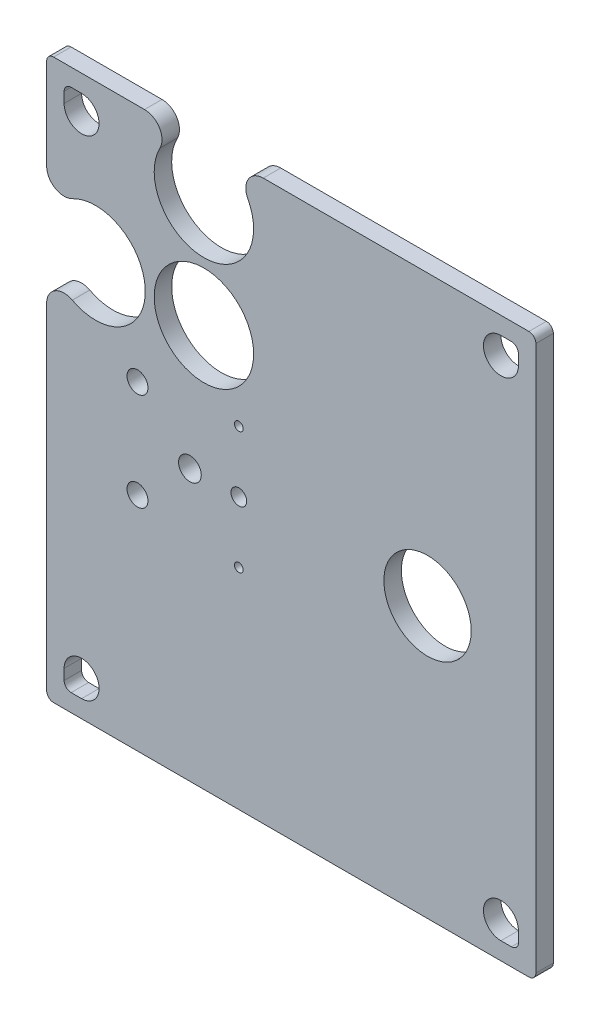
from build123d import *

# Parameters (mm, degrees)
MODEL_R             = 3
MODEL_R_2           = 2.25
MODEL_R_3           = 1.25
MODEL_R_4           = 12.5
MODEL_R_5           = 3.25
MODEL_R_6           = 14.225
BOSS_EXTRUDE1_DEPTH = 5


with BuildPart() as part:
    # Model → Boss-Extrude1 (new body)
    with BuildSketch(Plane.XY):
        with BuildLine():
            Line((28.011750385, 160), (2, 160))
            ThreePointArc((2, 160), (0.585786438, 159.414213562), (0, 158))
            Line((0, 158), (0, 131.988249615))
            ThreePointArc((0, 131.988249615), (2.421581013, 127.704354714), (7.340702211, 127.569979234))
            ThreePointArc((7.340702211, 127.569979234), (28.225, 115), (7.340702211, 102.430020766))
            ThreePointArc((7.340702211, 102.430020766), (2.421581013, 102.295645286), (0, 98.011750385))
            Line((0, 98.011750385), (0, 2))
            ThreePointArc((0, 2), (0.585786438, 0.585786438), (2, 0))
            Line((2, 0), (138, 0))
            ThreePointArc((138, 0), (139.414213562, 0.585786438), (140, 2))
            Line((140, 2), (140, 158))
            ThreePointArc((140, 158), (139.414213562, 159.414213562), (138, 160))
            Line((138, 160), (61.988249616, 160))
            ThreePointArc((61.988249616, 160), (57.704354714, 157.578418987), (57.569979234, 152.659297789))
            ThreePointArc((57.569979234, 152.659297789), (45, 131.775), (32.430020766, 152.659297789))
            ThreePointArc((32.430020766, 152.659297789), (32.295645286, 157.578418987), (28.011750385, 160))
        make_face()
        with Locations((26, 91.5)):
            Circle(MODEL_R, mode=Mode.SUBTRACT)
        with Locations((55, 77.5)):
            Circle(MODEL_R_2, mode=Mode.SUBTRACT)
        with Locations((55, 60)):
            Circle(MODEL_R_3, mode=Mode.SUBTRACT)
        with Locations((109, 77.5)):
            Circle(MODEL_R_4, mode=Mode.SUBTRACT)
        with Locations((55, 95)):
            Circle(MODEL_R_3, mode=Mode.SUBTRACT)
        with Locations((26, 63.5)):
            Circle(MODEL_R, mode=Mode.SUBTRACT)
        with Locations((41, 77.5)):
            Circle(MODEL_R_5, mode=Mode.SUBTRACT)
        with Locations((45, 115)):
            Circle(MODEL_R_6, mode=Mode.SUBTRACT)
        with BuildLine():
            Line((5, 153), (5, 150))
            ThreePointArc((5, 150), (13.535533906, 146.464466094), (10, 155))
            Line((10, 155), (7, 155))
            ThreePointArc((7, 155), (5.585786438, 154.414213562), (5, 153))
        make_face(mode=Mode.SUBTRACT)
        with BuildLine():
            Line((7, 5), (10, 5))
            ThreePointArc((10, 5), (13.535533906, 13.535533906), (5, 10))
            Line((5, 10), (5, 7))
            ThreePointArc((5, 7), (5.585786438, 5.585786438), (7, 5))
        make_face(mode=Mode.SUBTRACT)
        with BuildLine():
            Line((135, 7), (135, 10))
            ThreePointArc((135, 10), (126.464466094, 13.535533906), (130, 5))
            Line((130, 5), (133, 5))
            ThreePointArc((133, 5), (134.414213562, 5.585786438), (135, 7))
        make_face(mode=Mode.SUBTRACT)
        with BuildLine():
            Line((133, 155), (130, 155))
            ThreePointArc((130, 155), (126.464466094, 146.464466094), (135, 150))
            Line((135, 150), (135, 153))
            ThreePointArc((135, 153), (134.414213562, 154.414213562), (133, 155))
        make_face(mode=Mode.SUBTRACT)
    extrude(amount=BOSS_EXTRUDE1_DEPTH)


solid = part.part
